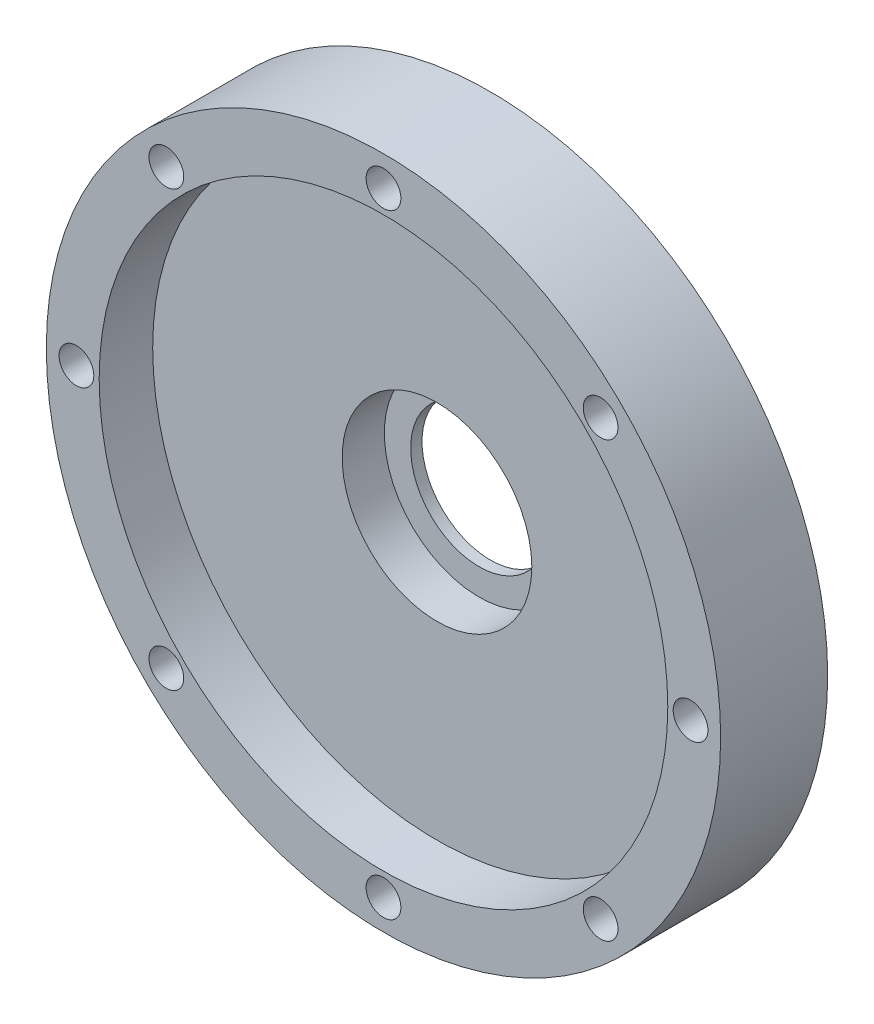
from build123d import *

# Parameters (mm, degrees)
SKETCH1_R             = 32.004
BOSS_EXTRUDE1_DEPTH   = 10.16
SKETCH2_R             = 26.9875
CUT_EXTRUDE1_DEPTH    = 5.08
SKETCH3_R             = 9
CUT_EXTRUDE2_DEPTH    = 4
SKETCH4_R             = 6.5
CUT_EXTRUDE3_DEPTH    = 47.162305315
M4X0_7_TAPPED_HOLE1_D = 3.3


with BuildPart() as part:
    # Sketch1 → Boss-Extrude1 (new body)
    with BuildSketch(Plane.XY):
        Circle(SKETCH1_R)
    extrude(amount=BOSS_EXTRUDE1_DEPTH)

    # Sketch2 → Cut-Extrude1 (cut)
    with BuildSketch(Plane.XY.offset(10.16)):
        Circle(SKETCH2_R)
    extrude(amount=-CUT_EXTRUDE1_DEPTH, mode=Mode.SUBTRACT)

    # Sketch3 → Cut-Extrude2 (cut)
    with BuildSketch(Plane.XY.offset(5.08)):
        Circle(SKETCH3_R)
    extrude(amount=-CUT_EXTRUDE2_DEPTH, mode=Mode.SUBTRACT)

    # Sketch4 → Cut-Extrude3 (cut, through all)
    with BuildSketch(Plane.XY.offset(1.08)):
        Circle(SKETCH4_R)
    extrude(amount=-CUT_EXTRUDE3_DEPTH, mode=Mode.SUBTRACT)

    # M4x0.7 Tapped Hole1 (through all)
    with Locations(Plane.XY.offset(10.16)):
        with Locations((-20.609687798, 20.609687798), (0, 29.1465), (20.609687798, 20.609687798), (29.1465, 0), (20.609687798, -20.609687798), (0, -29.1465), (-20.609687798, -20.609687798), (-29.1465, 0)):
            Hole(M4X0_7_TAPPED_HOLE1_D / 2)


solid = part.part
